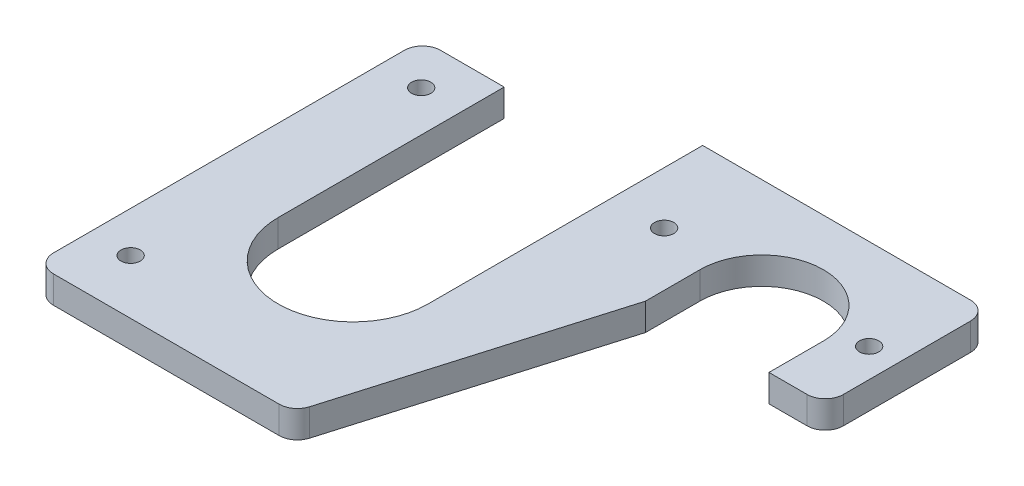
from build123d import *

# Parameters (mm, degrees)
BOSS_EXTRUDE1_DEPTH     = 9.525
SKETCH2_W               = 94.331668948
SKETCH2_H               = 25.4
CUT_EXTRUDE1_DEPTH      = 254.880909582
FILLET1_R               = 6.35
FILLET2_R               = 6.35
F_1_4_CLEARANCE_HOLE1_D = 6.7564


with BuildPart() as part:
    # Sketch1 → Boss-Extrude1 (new body)
    with BuildSketch(Plane(origin=(0, 0, 0), x_dir=(1, 0, 0), z_dir=(0, 1, 0))):
        with BuildLine():
            Line((28.575, 81.75625), (28.575, 160.782))
            Line((28.575, 160.782), (0, 160.782))
            Line((0, 160.782), (0, 0))
            Line((0, 0), (82.55, 0))
            Line((82.55, 0), (118.11, 120.65))
            Line((118.11, 120.65), (118.11, 139.7))
            ThreePointArc((118.11, 139.7), (139.7, 161.29), (161.29, 139.7))
            Line((161.29, 139.7), (161.29, 120.65))
            Line((161.29, 120.65), (180.975, 120.65))
            Line((180.975, 120.65), (180.975, 139.7))
            Line((180.975, 139.7), (180.975, 177.8))
            Line((180.975, 177.8), (121.7041, 177.8))
            Line((121.7041, 177.8), (80.9625, 177.8))
            Line((80.9625, 177.8), (80.9625, 81.75625))
            ThreePointArc((80.9625, 81.75625), (54.76875, 55.5625), (28.575, 81.75625))
        make_face()
    extrude(amount=BOSS_EXTRUDE1_DEPTH)

    # Sketch2 → Cut-Extrude1 (cut, through all)
    with BuildSketch(Plane(origin=(0, 9.525, 0), x_dir=(1, 0, 0), z_dir=(0, 1, 0))):
        with Locations((47.165834474, 12.7)):
            Rectangle(SKETCH2_W, SKETCH2_H)
    extrude(amount=-CUT_EXTRUDE1_DEPTH, mode=Mode.SUBTRACT)

    # Fillet1
    fillet1_edges = [part.edges().sort_by_distance(p)[0] for p in [
        (0, 4.7625, -25.4),
    ]]
    fillet(fillet1_edges, radius=FILLET1_R)

    # Fillet2
    fillet2_edges = [part.edges().sort_by_distance(p)[0] for p in [
        (0, 4.7625, -160.782),
        (180.975, 4.7625, -177.8),
        (180.975, 4.7625, -120.65),
        (90.036315789, 4.7625, -25.4),
    ]]
    fillet(fillet2_edges, radius=FILLET2_R)

    # 1/4 Clearance Hole1 (through all)
    with Locations(Plane(origin=(0, 9.525, 0), x_dir=(1, 0, 0), z_dir=(0, 1, 0))):
        with Locations((14.2875, 146.05), (14.2875, 44.45), (99.2378, 146.05), (170.92295, 146.05)):
            Hole(F_1_4_CLEARANCE_HOLE1_D / 2)


solid = part.part
